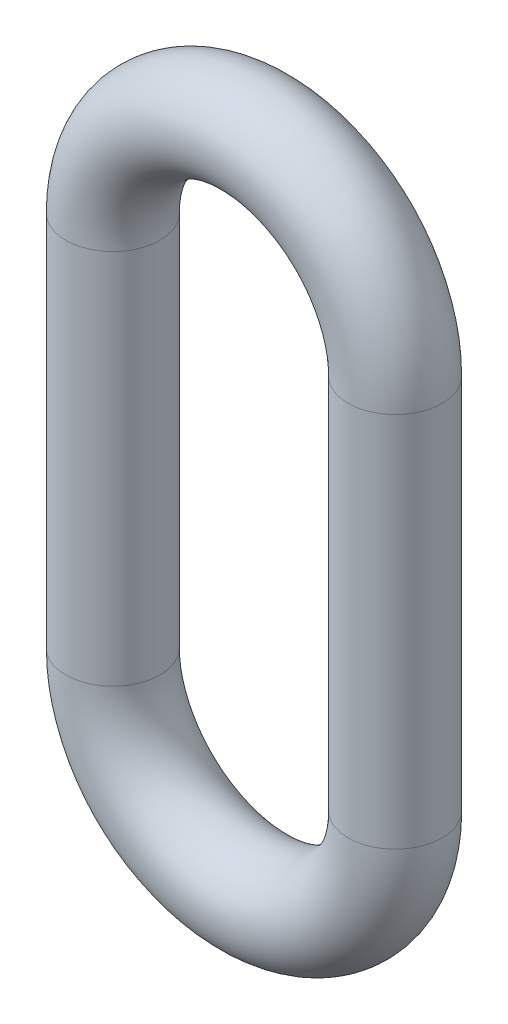
from build123d import *

# Parameters (mm, degrees)
SKETCH_2_R = 1.5


with BuildPart() as part:
    # По траектории1: sweep along a path in Эскиз1
    with BuildLine(Plane.XY) as sweep_1_path:
        Line((-4.5, 0), (-4.5, 12))
        ThreePointArc((-4.5, 12), (0, 16.5), (4.5, 12))
        Line((4.5, 12), (4.5, 0))
        ThreePointArc((4.5, 0), (0, -4.5), (-4.5, 0))
    # Эскиз2 → По траектории1 (sweep)
    with BuildSketch(Plane(origin=(0, 0, 0), x_dir=(1, 0, 0), z_dir=(0, 1, 0))):
        with Locations((-4.5, 0)):
            Circle(SKETCH_2_R)
    sweep(path=sweep_1_path.line)


solid = part.part
